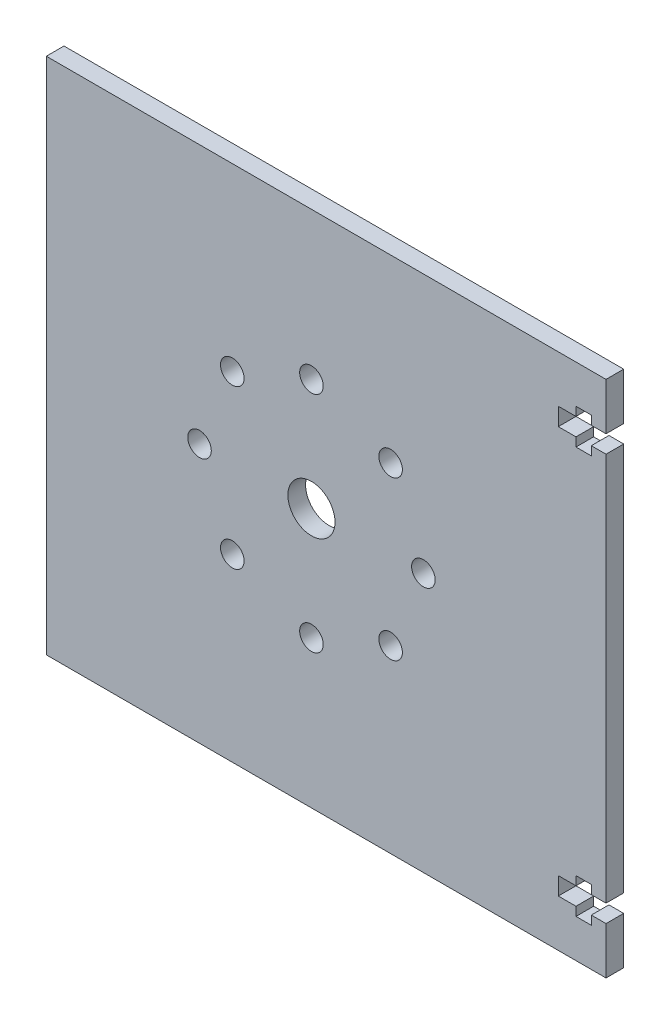
from build123d import *

# Parameters (mm, degrees)
SKETCH_1_R      = 4
SKETCH_1_R_2    = 2
EXTRUDE_1_DEPTH = 3


with BuildPart() as part:
    # 草图1 → 凸台-拉伸1 (new body)
    with BuildSketch(Plane.XY):
        Polygon((50, 44), (50, 36), (47.5, 36), (47.5, 37.5), (44.9, 37.5), (44.9, 36), (41.9, 36), (41.9, 33), (44.9, 33), (44.9, 31.5), (47.5, 31.5), (47.5, 33), (50, 33), (50, -33), (47.5, -33), (47.5, -31.5), (44.9, -31.5), (44.9, -33), (41.9, -33), (41.9, -36), (44.9, -36), (44.9, -37.5), (47.5, -37.5), (47.5, -36), (50, -36), (50, -44), (-45.00536, -44), (-45.00536, 44), align=None)
        Circle(SKETCH_1_R, mode=Mode.SUBTRACT)
        with Locations((0, -19)):
            Circle(SKETCH_1_R_2, mode=Mode.SUBTRACT)
        with Locations((-13.435028843, -13.435028843)):
            Circle(SKETCH_1_R_2, mode=Mode.SUBTRACT)
        with Locations((-19, 0)):
            Circle(SKETCH_1_R_2, mode=Mode.SUBTRACT)
        with Locations((-13.435028843, 13.435028843)):
            Circle(SKETCH_1_R_2, mode=Mode.SUBTRACT)
        with Locations((0, 19)):
            Circle(SKETCH_1_R_2, mode=Mode.SUBTRACT)
        with Locations((13.435028843, 13.435028843)):
            Circle(SKETCH_1_R_2, mode=Mode.SUBTRACT)
        with Locations((19, 0)):
            Circle(SKETCH_1_R_2, mode=Mode.SUBTRACT)
        with Locations((13.435028843, -13.435028843)):
            Circle(SKETCH_1_R_2, mode=Mode.SUBTRACT)
    extrude(amount=EXTRUDE_1_DEPTH)


solid = part.part
